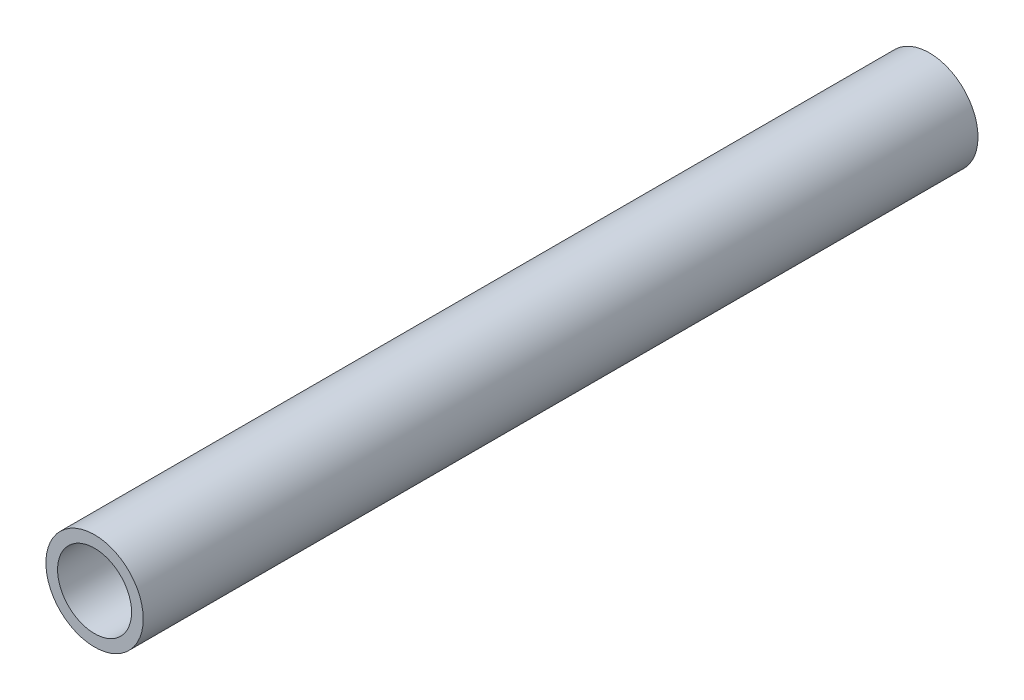
from build123d import *

# Parameters (mm, degrees)
SKETCH2_R           = 16.7005
SKETCH2_R_2         = 12.7
EXTRUDE_THIN1_DEPTH = 286.512


with BuildPart() as part:
    # Sketch2 → Extrude-Thin1 (new body)
    with BuildSketch(Plane.XY):
        Circle(SKETCH2_R)
        Circle(SKETCH2_R_2, mode=Mode.SUBTRACT)
    extrude(amount=EXTRUDE_THIN1_DEPTH)


solid = part.part
